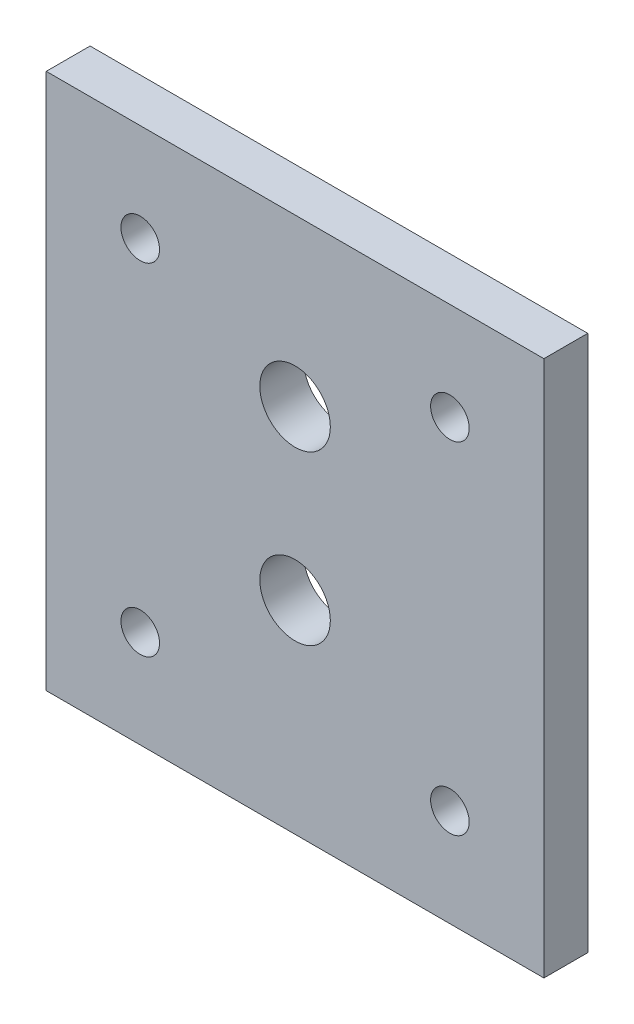
from build123d import *

# Parameters (mm, degrees)
SKETCH1_W           = 36.024962638
SKETCH1_H           = 38.826904176
SKETCH1_R           = 1.397
SKETCH1_R_2         = 2.5527
BOSS_EXTRUDE1_DEPTH = 3.175


with BuildPart() as part:
    # Sketch1 → Boss-Extrude1 (new body)
    with BuildSketch(Plane.XY):
        with Locations((34.711147671, -14.342506761)):
            Rectangle(SKETCH1_W, SKETCH1_H)
        with Locations((45.918913825, -2.000621413)):
            Circle(SKETCH1_R, mode=Mode.SUBTRACT)
        with Locations((23.503381517, -2.000621413)):
            Circle(SKETCH1_R, mode=Mode.SUBTRACT)
        with Locations((23.503381517, -26.684392109)):
            Circle(SKETCH1_R, mode=Mode.SUBTRACT)
        with Locations((45.918913825, -26.684392109)):
            Circle(SKETCH1_R, mode=Mode.SUBTRACT)
        with Locations((34.711147671, -6.937375552)):
            Circle(SKETCH1_R_2, mode=Mode.SUBTRACT)
        with Locations((34.711147671, -19.079122219)):
            Circle(SKETCH1_R_2, mode=Mode.SUBTRACT)
    extrude(amount=BOSS_EXTRUDE1_DEPTH)


solid = part.part
